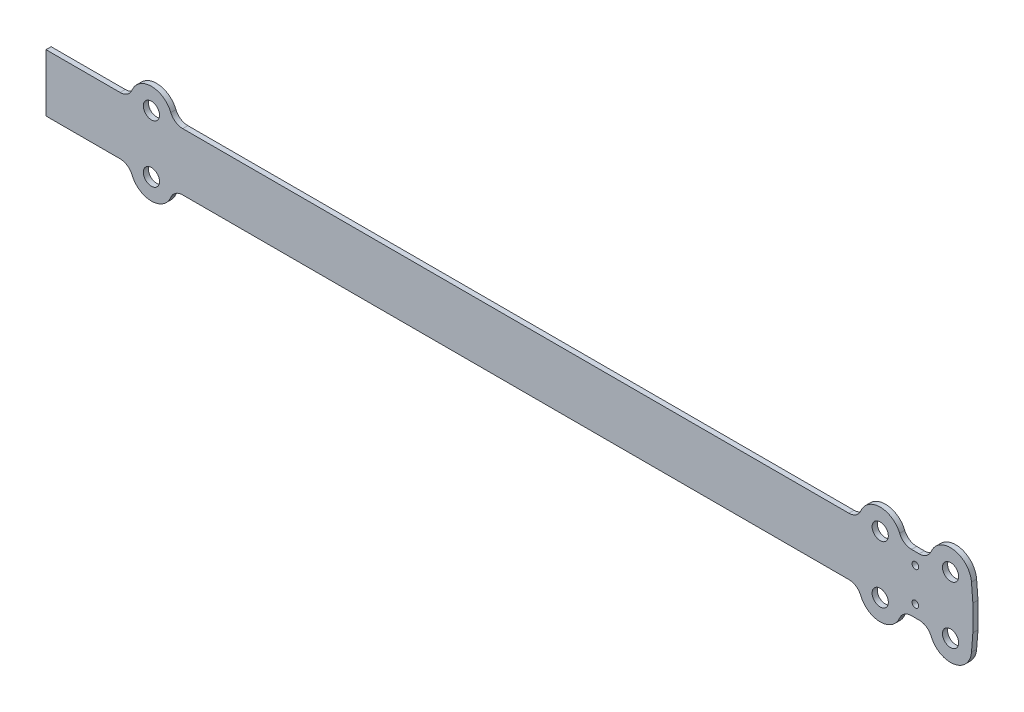
from build123d import *

# Parameters (mm, degrees)
SKETCH2_R           = 4
SKETCH2_R_2         = 1.651
BOSS_EXTRUDE1_DEPTH = 2.54
FILLET2_R           = 6.35


with BuildPart() as part:
    # Sketch2 → Boss-Extrude1 (new body)
    with BuildSketch(Plane(origin=(33.288009597, -76.684680992, 167.069664602), x_dir=(1, 0, 0), z_dir=(0, 0, 1))):
        with BuildLine():
            ThreePointArc((456.517892766, 21.339609639), (445.792378932, 30.866970077), (435.85, 20.525))
            Line((435.85, 20.525), (421.85, 20.525))
            ThreePointArc((421.85, 20.525), (411.5, 30.875), (401.15, 20.525))
            Line((401.15, 20.525), (62.352851741, 20.525))
            ThreePointArc((62.352851741, 20.525), (52.002851741, 30.875), (41.652851741, 20.525))
            Line((41.652851741, 20.525), (0, 20.525))
            Line((0, 20.525), (0, -7.825))
            Line((0, -7.825), (41.652851741, -7.825))
            ThreePointArc((41.652851741, -7.825), (52.002851741, -18.175), (62.352851741, -7.825))
            Line((62.352851741, -7.825), (401.15, -7.825))
            ThreePointArc((401.15, -7.825), (411.5, -18.175), (421.85, -7.825))
            Line((421.85, -7.825), (435.85, -7.825))
            ThreePointArc((435.85, -7.825), (445.792378932, -18.166970077), (456.517892766, -8.639609639))
            Line((456.517892766, -8.639609639), (457.2, 0))
            Line((457.2, 0), (457.2, 12.7))
            Line((457.2, 12.7), (456.517892766, 21.339609639))
        make_face()
        with Locations((52.002851741, -7.825)):
            Circle(SKETCH2_R, mode=Mode.SUBTRACT)
        with Locations((411.5, -7.825)):
            Circle(SKETCH2_R, mode=Mode.SUBTRACT)
        with Locations((428.85, -1.905)):
            Circle(SKETCH2_R_2, mode=Mode.SUBTRACT)
        with Locations((52.002851741, 20.525)):
            Circle(SKETCH2_R, mode=Mode.SUBTRACT)
        with Locations((428.85, 14.605)):
            Circle(SKETCH2_R_2, mode=Mode.SUBTRACT)
        with Locations((411.5, 20.525)):
            Circle(SKETCH2_R, mode=Mode.SUBTRACT)
        with Locations((446.2, 20.525)):
            Circle(SKETCH2_R, mode=Mode.SUBTRACT)
        with Locations((446.2, -7.825)):
            Circle(SKETCH2_R, mode=Mode.SUBTRACT)
    extrude(amount=BOSS_EXTRUDE1_DEPTH)

    # Fillet2
    fillet2_edges = [part.edges().sort_by_distance(p)[0] for p in [
        (95.640861339, -84.509680992, 168.339664602),
        (74.940861339, -84.509680992, 168.339664602),
        (74.940861339, -56.159680992, 168.339664602),
        (95.640861339, -56.159680992, 168.339664602),
        (434.438009597, -56.159680992, 168.339664602),
        (455.138009597, -56.159680992, 168.339664602),
        (469.138009597, -56.159680992, 168.339664602),
        (469.138009597, -84.509680992, 168.339664602),
        (455.138009597, -84.509680992, 168.339664602),
        (434.438009597, -84.509680992, 168.339664602),
    ]]
    fillet(fillet2_edges, radius=FILLET2_R)


solid = part.part
